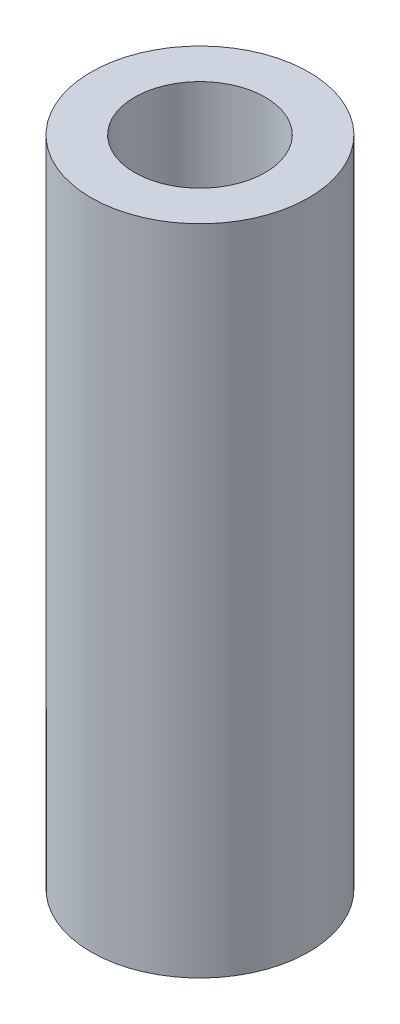
from build123d import *

# Parameters (mm, degrees)
SKETCH_1_R          = 25
EXTRUDE_1_DEPTH     = 75
SKETCH_2_R          = 15
CUT_EXTRUDE_1_DEPTH = 155.110350074


with BuildPart() as part:
    # 스케치1 → 보스-돌출1 (new, symmetric)
    with BuildSketch(Plane(origin=(0, 0, 0), x_dir=(1, 0, 0), z_dir=(0, 1, 0))):
        with Locations(Location((0, 0, 0), (0, 0, 270))):
            Circle(SKETCH_1_R)
    extrude(amount=EXTRUDE_1_DEPTH, both=True)

    # 스케치2 → 컷-돌출1 (cut, through all)
    with BuildSketch(Plane(origin=(0, 75, 0), x_dir=(1, 0, 0), z_dir=(0, 1, 0))):
        with Locations(Location((0, 0, 0), (0, 0, 270))):
            Circle(SKETCH_2_R)
    extrude(amount=-CUT_EXTRUDE_1_DEPTH, mode=Mode.SUBTRACT)


solid = part.part
